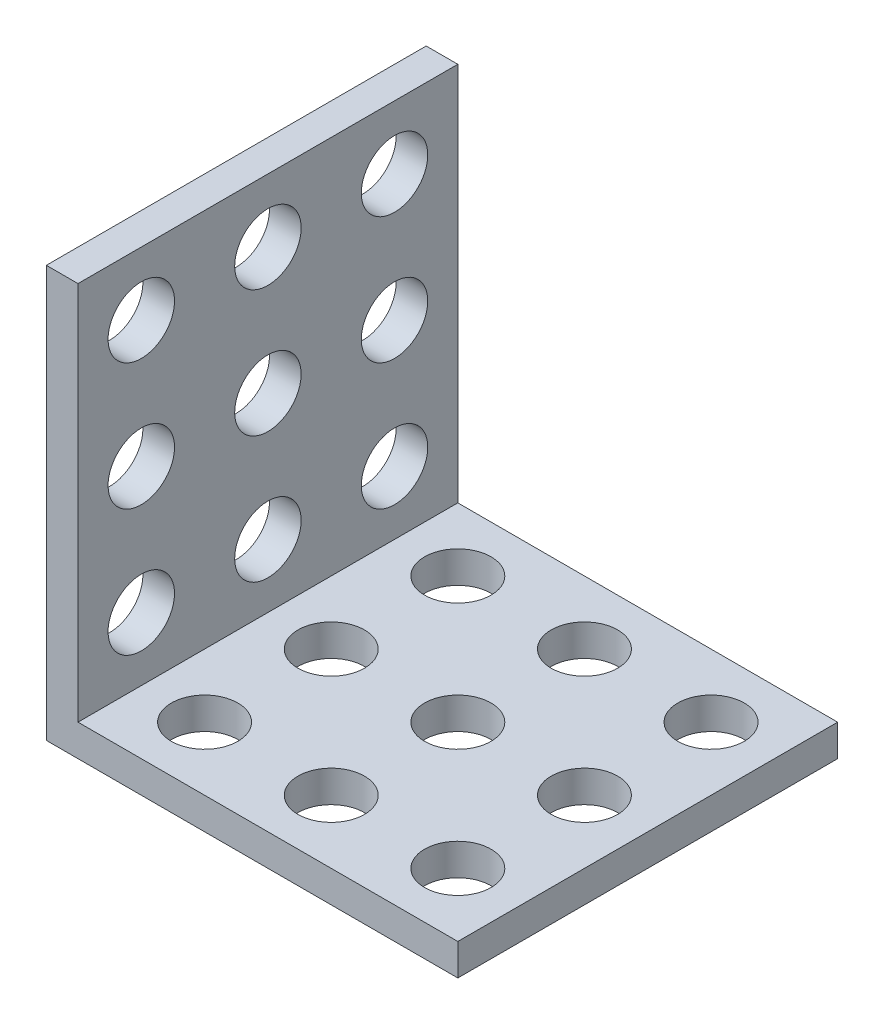
from build123d import *

# Parameters (mm, degrees)
EXTRU_MINCE1_DEPTH              = 24
ESQUISSE2_R                     = 2.1
ENL_V_MAT_EXTRU_1_DEPTH         = 42.569219382
R_P_TITION_LIN_AIRE1_COUNT      = 3
R_P_TITION_LIN_AIRE1_PITCH      = 8
R_P_TITION_LIN_AIRE1_COUNT_DIR2 = 3
R_P_TITION_LIN_AIRE1_PITCH_DIR2 = 8
ESQUISSE3_R                     = 2.1
ENL_V_MAT_EXTRU_2_DEPTH         = 42.569219382
R_P_TITION_LIN_AIRE2_COUNT      = 3
R_P_TITION_LIN_AIRE2_PITCH      = 8
R_P_TITION_LIN_AIRE2_COUNT_DIR2 = 3
R_P_TITION_LIN_AIRE2_PITCH_DIR2 = 8


with BuildPart() as part:
    # Esquisse1 → Extru.-Mince1 (new body)
    with BuildSketch(Plane.XY):
        Polygon((0, 24), (0, 0), (24, 0), (24, -2), (-2, -2), (-2, 24), align=None)
    extrude(amount=EXTRU_MINCE1_DEPTH)

    # Esquisse2 → Enlèv. mat.-Extru.1 (cut, through all)
    with BuildSketch(Plane(origin=(0, 0, 0), x_dir=(1, 0, 0), z_dir=(0, 1, 0))):
        with Locations(Location((4, -20, 0), (0, 0, 270))):
            Circle(ESQUISSE2_R)
    enl_v_mat_extru_1 = extrude(amount=-ENL_V_MAT_EXTRU_1_DEPTH, mode=Mode.SUBTRACT)

    # Répétition linéaire1: Enl_v. mat.-Extru.1 3 × 3
    with Locations(*[(i * R_P_TITION_LIN_AIRE1_PITCH, 0, -j * R_P_TITION_LIN_AIRE1_PITCH_DIR2) for i in range(R_P_TITION_LIN_AIRE1_COUNT) for j in range(R_P_TITION_LIN_AIRE1_COUNT_DIR2) if (i, j) != (0, 0)]):
        add(enl_v_mat_extru_1, mode=Mode.SUBTRACT)

    # Esquisse3 → Enlèv. mat.-Extru.2 (cut, through all)
    with BuildSketch(Plane(origin=(0, 0, 0), x_dir=(0, 0, -1), z_dir=(1, 0, 0))):
        with Locations(Location((-20, 4, 0), (0, 0, 90))):
            Circle(ESQUISSE3_R)
    enl_v_mat_extru_2 = extrude(amount=-ENL_V_MAT_EXTRU_2_DEPTH, mode=Mode.SUBTRACT)

    # Répétition linéaire2: Enl_v. mat.-Extru.2 3 × 3
    with Locations(*[(0, i * R_P_TITION_LIN_AIRE2_PITCH, -j * R_P_TITION_LIN_AIRE2_PITCH_DIR2) for i in range(R_P_TITION_LIN_AIRE2_COUNT) for j in range(R_P_TITION_LIN_AIRE2_COUNT_DIR2) if (i, j) != (0, 0)]):
        add(enl_v_mat_extru_2, mode=Mode.SUBTRACT)


solid = part.part
